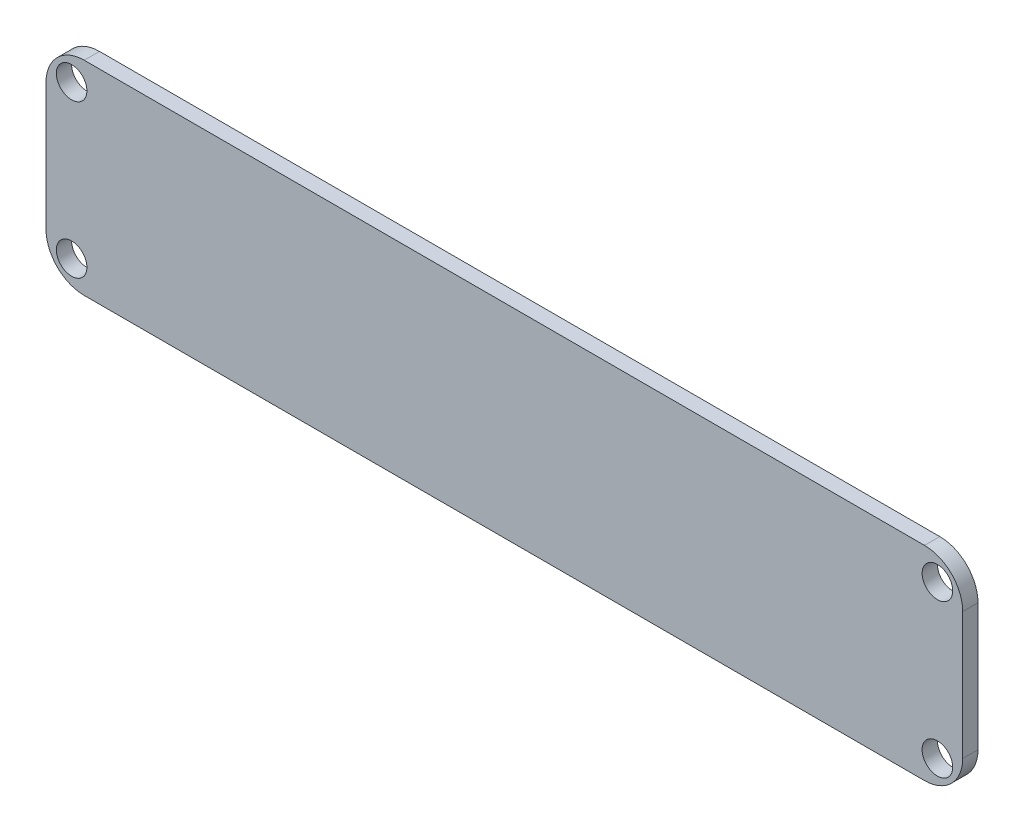
from build123d import *

# Parameters (mm, degrees)
SKETCH_1_W          = 72
SKETCH_1_H          = 16
EXTRUDE_1_DEPTH     = 1.2
FILLET_1_R          = 3
CUT_EXTRUDE_1_REACH = 75.766
SKETCH_3_R          = 1.2


with BuildPart() as part:
    # 草图1 → 凸台-拉伸1 (new body)
    with BuildSketch(Plane.XY):
        with Locations((36, 8)):
            Rectangle(SKETCH_1_W, SKETCH_1_H)
    extrude(amount=EXTRUDE_1_DEPTH)

    # 圆角1
    fillet_1_edges = [part.edges().sort_by_distance(p)[0] for p in [
        (0, 16, 0.6),
        (72, 16, 0.6),
        (72, 0, 0.6),
        (0, 0, 0.6),
    ]]
    fillet(fillet_1_edges, radius=FILLET_1_R)

    # 草图3 → 切除-拉伸1 (cut, up to next)
    with BuildSketch(Plane(origin=(0, 0, 0), x_dir=(-1, 0, 0), z_dir=(0, 0, -1)), mode=Mode.PRIVATE) as cut_extrude_1_sk1:
        with Locations((-70.012877826, 14.013032766)):
            Circle(SKETCH_3_R)
    cut_extrude_1_tool1 = extrude(cut_extrude_1_sk1.sketch, amount=-CUT_EXTRUDE_1_REACH, mode=Mode.PRIVATE) & part.part
    # 草图3 → 切除-拉伸1 (cut, up to next)
    with BuildSketch(Plane(origin=(0, 0, 0), x_dir=(-1, 0, 0), z_dir=(0, 0, -1)), mode=Mode.PRIVATE) as cut_extrude_1_sk2:
        with Locations((-70.012694945, 2.012672085)):
            Circle(SKETCH_3_R)
    cut_extrude_1_tool2 = extrude(cut_extrude_1_sk2.sketch, amount=-CUT_EXTRUDE_1_REACH, mode=Mode.PRIVATE) & part.part
    # 草图3 → 切除-拉伸1 (cut, up to next)
    with BuildSketch(Plane(origin=(0, 0, 0), x_dir=(-1, 0, 0), z_dir=(0, 0, -1)), mode=Mode.PRIVATE) as cut_extrude_1_sk3:
        with Locations((-2.011949988, 14.012003328)):
            Circle(SKETCH_3_R)
    cut_extrude_1_tool3 = extrude(cut_extrude_1_sk3.sketch, amount=-CUT_EXTRUDE_1_REACH, mode=Mode.PRIVATE) & part.part
    # 草图3 → 切除-拉伸1 (cut, up to next)
    with BuildSketch(Plane(origin=(0, 0, 0), x_dir=(-1, 0, 0), z_dir=(0, 0, -1)), mode=Mode.PRIVATE) as cut_extrude_1_sk4:
        with Locations((-2.012501905, 2.013009906)):
            Circle(SKETCH_3_R)
    cut_extrude_1_tool4 = extrude(cut_extrude_1_sk4.sketch, amount=-CUT_EXTRUDE_1_REACH, mode=Mode.PRIVATE) & part.part
    add(cut_extrude_1_tool1.solids().sort_by_distance((70.012878, 14.013033, 0))[0], mode=Mode.SUBTRACT)
    add(cut_extrude_1_tool2.solids().sort_by_distance((70.012695, 2.012672, 0))[0], mode=Mode.SUBTRACT)
    add(cut_extrude_1_tool3.solids().sort_by_distance((2.01195, 14.012003, 0))[0], mode=Mode.SUBTRACT)
    add(cut_extrude_1_tool4.solids().sort_by_distance((2.012502, 2.01301, 0))[0], mode=Mode.SUBTRACT)


solid = part.part
